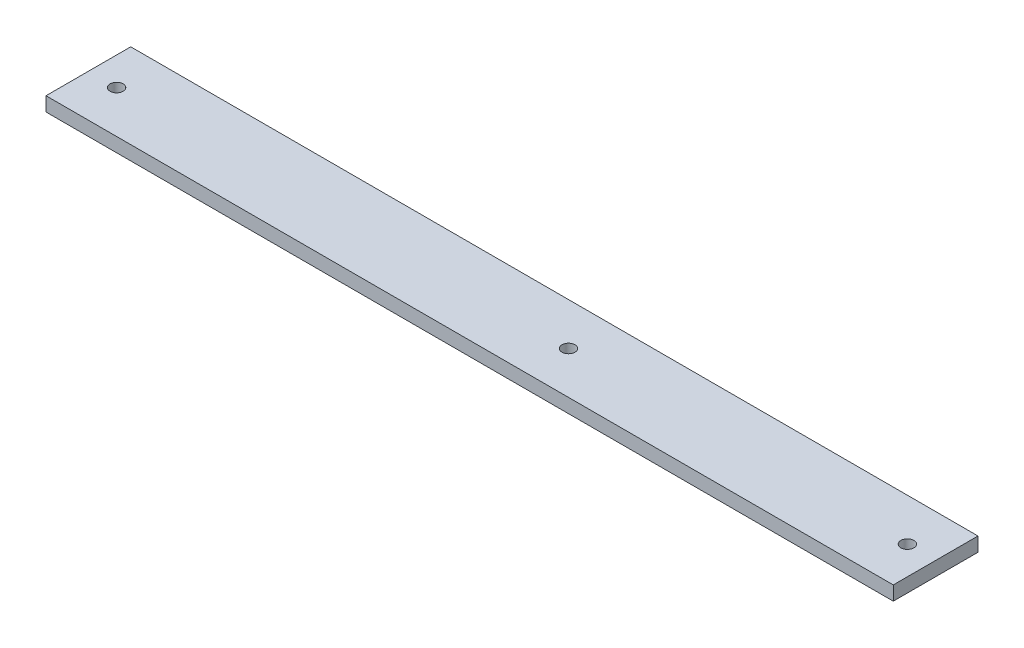
from build123d import *

# Parameters (mm, degrees)
SKETCH2_W           = 190.5
SKETCH2_H           = 19.05
SKETCH2_R           = 1.4605
BOSS_EXTRUDE1_DEPTH = 3.175


with BuildPart() as part:
    # Sketch2 → Boss-Extrude1 (new body)
    with BuildSketch(Plane(origin=(0, 0, 0), x_dir=(1, 0, 0), z_dir=(0, 1, 0))):
        with Locations((95.25, 9.525)):
            Rectangle(SKETCH2_W, SKETCH2_H)
        with Locations(Location((6.35, 9.525, 0), (0, 0, 270))):
            Circle(SKETCH2_R, mode=Mode.SUBTRACT)
        with Locations(Location((184.15, 9.525, 0), (0, 0, 270))):
            Circle(SKETCH2_R, mode=Mode.SUBTRACT)
        with Locations(Location((107.95, 9.525, 0), (0, 0, 270))):
            Circle(SKETCH2_R, mode=Mode.SUBTRACT)
    extrude(amount=BOSS_EXTRUDE1_DEPTH)


solid = part.part
